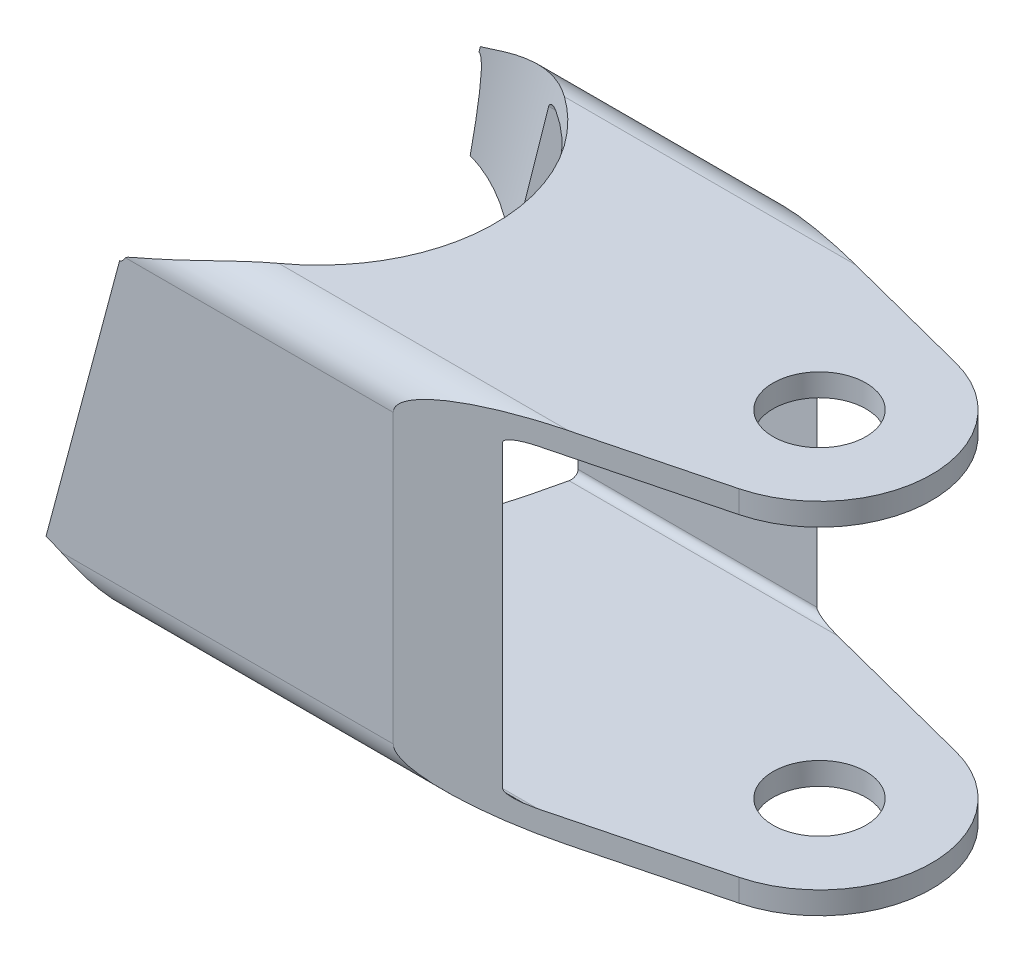
from build123d import *

# Parameters (mm, degrees)
BOSS_EXTRUDE1_DEPTH      = 25.4
BOSS_EXTRUDE1_DEPTH_BACK = 34.925
CUT_EXTRUDE4_DEPTH       = 63.941922635
CUT_EXTRUDE5_DEPTH       = 46.01339384
SKETCH14_R               = 3.2893
CUT_EXTRUDE6_DEPTH       = 46.01339384
CUT_EXTRUDE7_DEPTH       = 25.4
CUT_EXTRUDE7_DEPTH_BACK  = 25.4
SKETCH15_R               = 12.7
CUT_EXTRUDE9_DEPTH       = 6.35
CUT_EXTRUDE9_DEPTH_BACK  = 12.7
SKETCH17_R               = 12.7
CUT_EXTRUDE10_DEPTH      = 6.35
CUT_EXTRUDE10_DEPTH_BACK = 25.4
SKETCH18_R               = 12.7
CUT_EXTRUDE11_DEPTH      = 25.4
CUT_EXTRUDE11_DEPTH_BACK = 25.4
SKETCH19_R               = 12.7
SKETCH21_W               = 55.072089952
SKETCH21_H               = 45.053463364
CUT_EXTRUDE12_DEPTH      = 51.98499249


with BuildPart() as part:
    # Sketch1 → Boss-Extrude1 (new, two sides: drawn at the far end of the back side and taken through both)
    with BuildSketch(Plane(origin=(0, 0, 0), x_dir=(0, 0, -1), z_dir=(1, 0, 0)).offset(-BOSS_EXTRUDE1_DEPTH_BACK)):
        with BuildLine():
            Line((-10.16, 12.7), (10.16, 12.7))
            ThreePointArc((10.16, 12.7), (11.956051224, 11.956051224), (12.7, 10.16))
            Line((12.7, 10.16), (12.7, -10.16))
            ThreePointArc((12.7, -10.16), (11.956051224, -11.956051224), (10.16, -12.7))
            Line((10.16, -12.7), (-10.16, -12.7))
            ThreePointArc((-10.16, -12.7), (-11.956051224, -11.956051224), (-12.7, -10.16))
            Line((-12.7, -10.16), (-12.7, 10.16))
            ThreePointArc((-12.7, 10.16), (-11.956051224, 11.956051224), (-10.16, 12.7))
        make_face()
    extrude(amount=BOSS_EXTRUDE1_DEPTH + BOSS_EXTRUDE1_DEPTH_BACK)

    # Sketch11 → Cut-Extrude4 (cut, through all)
    with BuildSketch(Plane(origin=(25.4, 0, 0), x_dir=(0, 0, -1), z_dir=(1, 0, 0))):
        with BuildLine():
            Line((-10.6045, 11.1125), (10.6045, 11.1125))
            ThreePointArc((10.6045, 11.1125), (10.963710245, 10.963710245), (11.1125, 10.6045))
            Line((11.1125, 10.6045), (11.1125, -10.6045))
            ThreePointArc((11.1125, -10.6045), (10.963710245, -10.963710245), (10.6045, -11.1125))
            Line((10.6045, -11.1125), (-10.6045, -11.1125))
            ThreePointArc((-10.6045, -11.1125), (-10.963710245, -10.963710245), (-11.1125, -10.6045))
            Line((-11.1125, -10.6045), (-11.1125, 10.6045))
            ThreePointArc((-11.1125, 10.6045), (-10.963710245, 10.963710245), (-10.6045, 11.1125))
        make_face()
    extrude(amount=-CUT_EXTRUDE4_DEPTH, mode=Mode.SUBTRACT)

    # Sketch12 → Cut-Extrude5 (cut, through all)
    with BuildSketch(Plane(origin=(0, 12.7, 0), x_dir=(1, 0, 0), z_dir=(0, 1, 0))):
        with BuildLine():
            Line((50.8, 12.7), (0, 12.7))
            Line((0, 12.7), (19.444424463, 7.686083637))
            ThreePointArc((19.444424463, 7.686083637), (25.4, 0), (19.444424463, -7.686083637))
            Line((19.444424463, -7.686083637), (0, -12.7))
            Line((0, -12.7), (50.8, -12.7))
            Line((50.8, -12.7), (50.8, 12.7))
        make_face()
    extrude(amount=-CUT_EXTRUDE5_DEPTH, mode=Mode.SUBTRACT)

    # Sketch14 → Cut-Extrude6 (cut, through all)
    with BuildSketch(Plane(origin=(0, 12.7, 0), x_dir=(1, 0, 0), z_dir=(0, 1, 0))):
        with Locations((17.4625, 0)):
            Circle(SKETCH14_R)
    extrude(amount=-CUT_EXTRUDE6_DEPTH, mode=Mode.SUBTRACT)

    # Sketch15 → Cut-Extrude7 (cut, two sides: drawn at the far end of the back side and taken through both)
    with BuildSketch(Plane(origin=(-24.376511464, -12.7, -8.774837607), x_dir=(-0.9763290145154152, 0.09548845507502755, -0.19407114768234504), z_dir=(0.21629067343590694, 0.43103175814294786, -0.87603080314384)).offset(-CUT_EXTRUDE7_DEPTH_BACK)):
        Circle(SKETCH15_R)
    extrude(amount=CUT_EXTRUDE7_DEPTH + CUT_EXTRUDE7_DEPTH_BACK, mode=Mode.SUBTRACT)

    # Sketch17 → Cut-Extrude9 (cut, two sides: drawn at the far end of the back side and taken through both)
    with BuildSketch(Plane(origin=(-27.308043482, -12.7, -1.06807503), x_dir=(0.9824624854144781, 0.18269743061253085, -0.037270814329526), z_dir=(-0.18646035705534442, 0.962635568187557, -0.1963804931937306)).offset(-CUT_EXTRUDE9_DEPTH_BACK)):
        Circle(SKETCH17_R)
    extrude(amount=CUT_EXTRUDE9_DEPTH + CUT_EXTRUDE9_DEPTH_BACK, mode=Mode.SUBTRACT)

    # Sketch18 → Cut-Extrude10 (cut, two sides: drawn at the far end of the back side and taken through both)
    with BuildSketch(Plane(origin=(-34.925, -14.662329374, -0.208196935), x_dir=(0, 0, -1), z_dir=(0.9661266940476223, -0.258068229444486, 0)).offset(-CUT_EXTRUDE10_DEPTH_BACK)):
        Circle(SKETCH18_R)
    extrude(amount=CUT_EXTRUDE10_DEPTH + CUT_EXTRUDE10_DEPTH_BACK, mode=Mode.SUBTRACT)

    # Sketch19 → Cut-Extrude11 (cut, two sides: drawn at the far end of the back side and taken through both)
    with BuildSketch(Plane(origin=(-21.973321652, 0, -0.076533546), x_dir=(0.9661286431417051, -0.2580531152287378, -0.0020086368292110716), z_dir=(0.25806093253564727, 0.9660993767043438, 0.007519935525700249)).offset(-CUT_EXTRUDE11_DEPTH_BACK)):
        Circle(SKETCH19_R)
    extrude(amount=CUT_EXTRUDE11_DEPTH + CUT_EXTRUDE11_DEPTH_BACK, mode=Mode.SUBTRACT)

    # Sketch21 → Cut-Extrude12 (cut, through all)
    with BuildSketch(Plane(origin=(-20.509915766, 5.478533696, 0), x_dir=(-0.25806093253564727, -0.9660993767043438, -0.00751993552570025), z_dir=(0.9661266940476224, -0.25806822944448593, 0))):
        Rectangle(SKETCH21_W, SKETCH21_H)
    extrude(amount=-CUT_EXTRUDE12_DEPTH, mode=Mode.SUBTRACT)


solid = part.part
